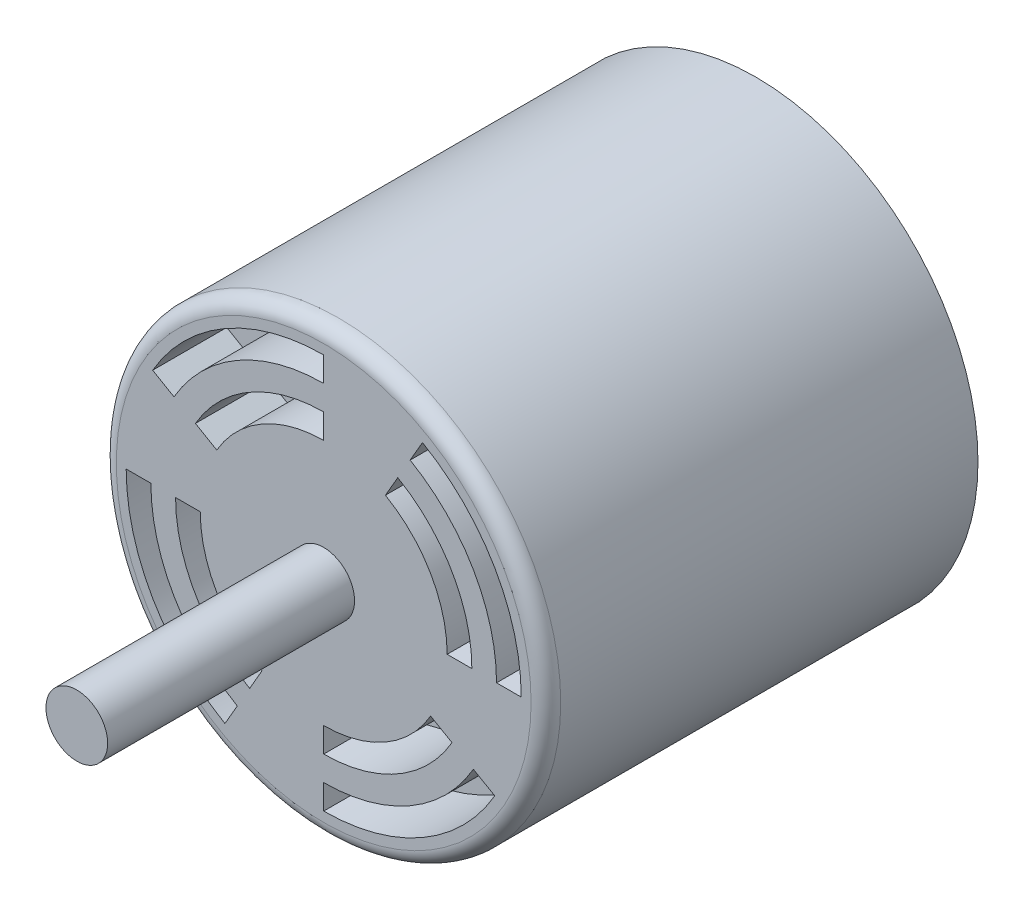
from build123d import *

# Parameters (mm, degrees)
SKETCH1_R           = 22.86
BOSS_EXTRUDE1_DEPTH = 44.45
SKETCH2_R           = 3.175
BOSS_EXTRUDE2_DEPTH = 25.4
CUT_EXTRUDE1_DEPTH  = 7.62
FILLET1_R           = 1.524


with BuildPart() as part:
    # Sketch1 → Boss-Extrude1 (new body)
    with BuildSketch(Plane.XY):
        Circle(SKETCH1_R)
    extrude(amount=BOSS_EXTRUDE1_DEPTH)

    # Sketch2 → Boss-Extrude2 (add)
    with BuildSketch(Plane.XY.offset(44.45)):
        Circle(SKETCH2_R)
    extrude(amount=BOSS_EXTRUDE2_DEPTH)

    # Sketch3 → Cut-Extrude1 (cut)
    with BuildSketch(Plane.XY.offset(44.45)):
        with BuildLine():
            Line((12.7, 0), (15.24, 0))
            ThreePointArc((15.24, 0), (13.198227154, 7.62), (7.62, 13.198227154))
            Line((7.62, 13.198227154), (6.35, 10.998522628))
            ThreePointArc((6.35, 10.998522628), (10.998522628, 6.35), (12.7, 0))
        make_face()
        with BuildLine():
            Line((8.89, 15.397931679), (10.16, 17.597636205))
            ThreePointArc((10.16, 17.597636205), (17.597636205, 10.16), (20.32, 0))
            Line((20.32, 0), (17.78, 0))
            ThreePointArc((17.78, 0), (15.397931679, 8.89), (8.89, 15.397931679))
        make_face()
        with BuildLine():
            Line((10.998522628, -6.35), (13.198227154, -7.62))
            ThreePointArc((13.198227154, -7.62), (7.62, -13.198227154), (0, -15.24))
            Line((0, -15.24), (0, -12.7))
            ThreePointArc((0, -12.7), (6.35, -10.998522628), (10.998522628, -6.35))
        make_face()
        with BuildLine():
            Line((15.397931679, -8.89), (17.597636205, -10.16))
            ThreePointArc((17.597636205, -10.16), (10.16, -17.597636205), (0, -20.32))
            Line((0, -20.32), (0, -17.78))
            ThreePointArc((0, -17.78), (8.89, -15.397931679), (15.397931679, -8.89))
        make_face()
        with BuildLine():
            Line((-6.35, -10.998522628), (-7.62, -13.198227154))
            ThreePointArc((-7.62, -13.198227154), (-13.198227154, -7.62), (-15.24, 0))
            Line((-15.24, 0), (-12.7, 0))
            ThreePointArc((-12.7, 0), (-10.998522628, -6.35), (-6.35, -10.998522628))
        make_face()
        with BuildLine():
            Line((-8.89, -15.397931679), (-10.16, -17.597636205))
            ThreePointArc((-10.16, -17.597636205), (-17.597636205, -10.16), (-20.32, 0))
            Line((-20.32, 0), (-17.78, 0))
            ThreePointArc((-17.78, 0), (-15.397931679, -8.89), (-8.89, -15.397931679))
        make_face()
        with BuildLine():
            Line((-10.998522628, 6.35), (-13.198227154, 7.62))
            ThreePointArc((-13.198227154, 7.62), (-7.62, 13.198227154), (0, 15.24))
            Line((0, 15.24), (0, 12.7))
            ThreePointArc((0, 12.7), (-6.35, 10.998522628), (-10.998522628, 6.35))
        make_face()
        with BuildLine():
            Line((-15.397931679, 8.89), (-17.597636205, 10.16))
            ThreePointArc((-17.597636205, 10.16), (-10.16, 17.597636205), (0, 20.32))
            Line((0, 20.32), (0, 17.78))
            ThreePointArc((0, 17.78), (-8.89, 15.397931679), (-15.397931679, 8.89))
        make_face()
    extrude(amount=-CUT_EXTRUDE1_DEPTH, mode=Mode.SUBTRACT)

    # Fillet1
    fillet1_edges = [part.edges().sort_by_distance(p)[0] for p in [
        (-22.86, 0, 44.45),
    ]]
    fillet(fillet1_edges, radius=FILLET1_R)


solid = part.part
